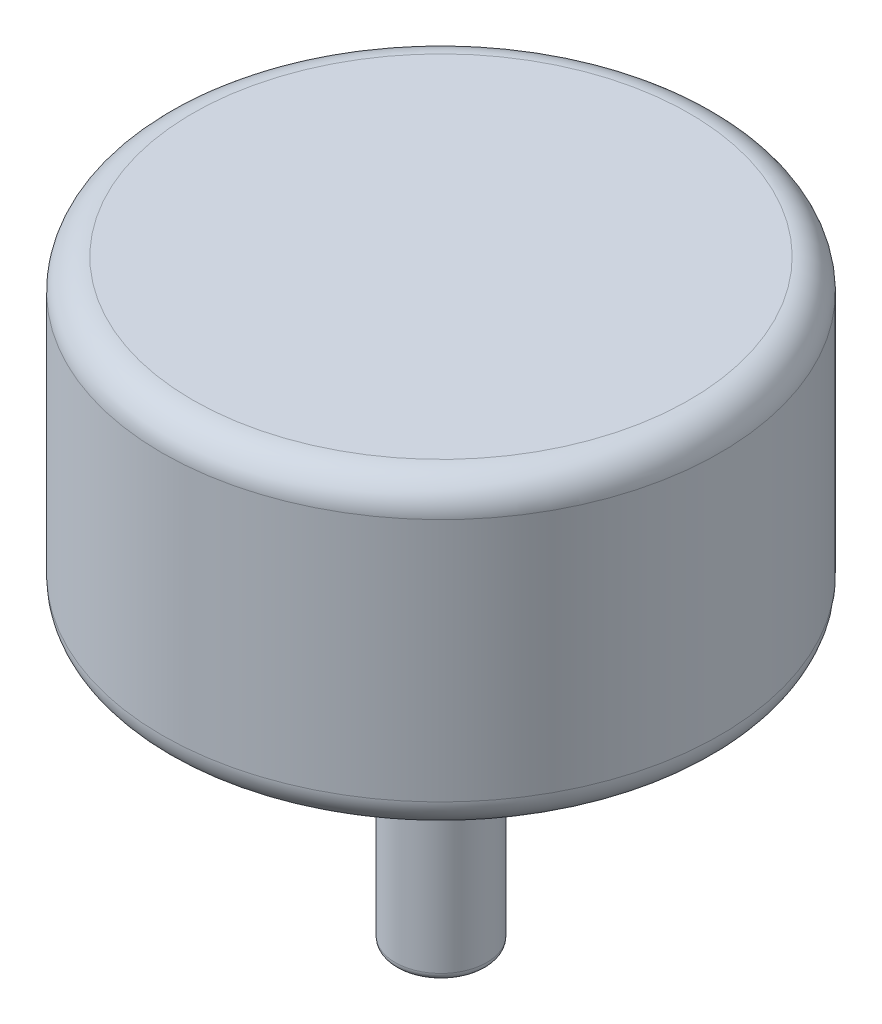
from build123d import *

# Parameters (mm, degrees)
SKETCH_1_R      = 18.25
EXTRUDE_1_DEPTH = 20
FILLET_1_R      = 2
SKETCH_2_R      = 10
EXTRUDE_2_DEPTH = 1.6
SKETCH_3_R      = 3
EXTRUDE_3_DEPTH = 19
FILLET_2_R      = 0.5


with BuildPart() as part:
    # 草图1 → 凸台-拉伸1 (new body)
    with BuildSketch(Plane(origin=(0, 0, 0), x_dir=(1, 0, 0), z_dir=(0, 1, 0))):
        with Locations(Location((0, 0, 0), (0, 0, 270))):
            Circle(SKETCH_1_R)
    extrude(amount=EXTRUDE_1_DEPTH)

    # 圆角1
    fillet_1_edges = [part.edges().sort_by_distance(p)[0] for p in [
        (0, 0, -18.25),
        (0, 20, -18.25),
    ]]
    fillet(fillet_1_edges, radius=FILLET_1_R)

    # 草图2 → 凸台-拉伸2 (add)
    with BuildSketch(Plane(origin=(0, 0, 0), x_dir=(1, 0, 0), z_dir=(0, 1, 0))):
        with Locations(Location((0, 0, 0), (0, 0, 270))):
            Circle(SKETCH_2_R)
    extrude(amount=-EXTRUDE_2_DEPTH)

    # 草图3 → 凸台-拉伸3 (add)
    with BuildSketch(Plane(origin=(0, 0, 0), x_dir=(1, 0, 0), z_dir=(0, 1, 0))):
        with Locations(Location((0, 0, 0), (0, 0, 270))):
            Circle(SKETCH_3_R)
    extrude(amount=-EXTRUDE_3_DEPTH)

    # 圆角2
    fillet_2_edges = [part.edges().sort_by_distance(p)[0] for p in [
        (0, -19, -3),
    ]]
    fillet(fillet_2_edges, radius=FILLET_2_R)


solid = part.part
